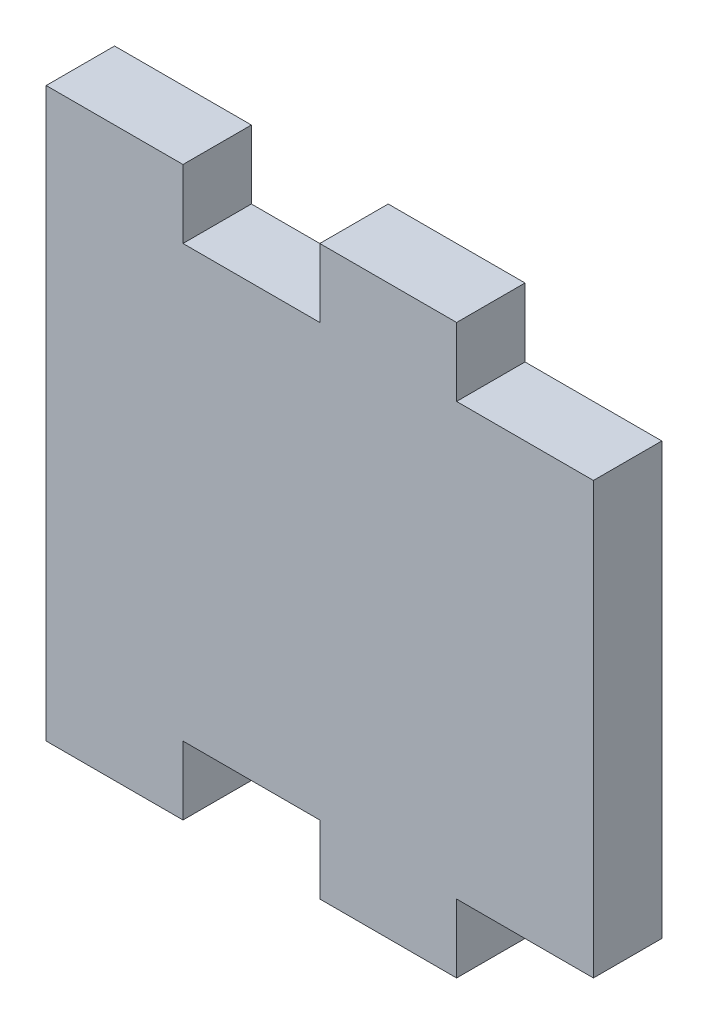
from build123d import *

# Parameters (mm, degrees)
BOSS_EXTRUDE1_DEPTH = 3.175


with BuildPart() as part:
    # Sketch1 → Boss-Extrude1 (new body)
    with BuildSketch(Plane.XY):
        Polygon((0, 0), (0, -3.175), (6.35, -3.175), (6.35, 0), (12.7, 0), (12.7, -3.175), (19.05, -3.175), (19.05, 0), (25.4, 0), (25.4, 20), (19.05, 20), (19.05, 23.175), (12.7, 23.175), (12.7, 20), (6.35, 20), (6.35, 23.175), (0, 23.175), (0, 20), align=None)
    extrude(amount=BOSS_EXTRUDE1_DEPTH)


solid = part.part
